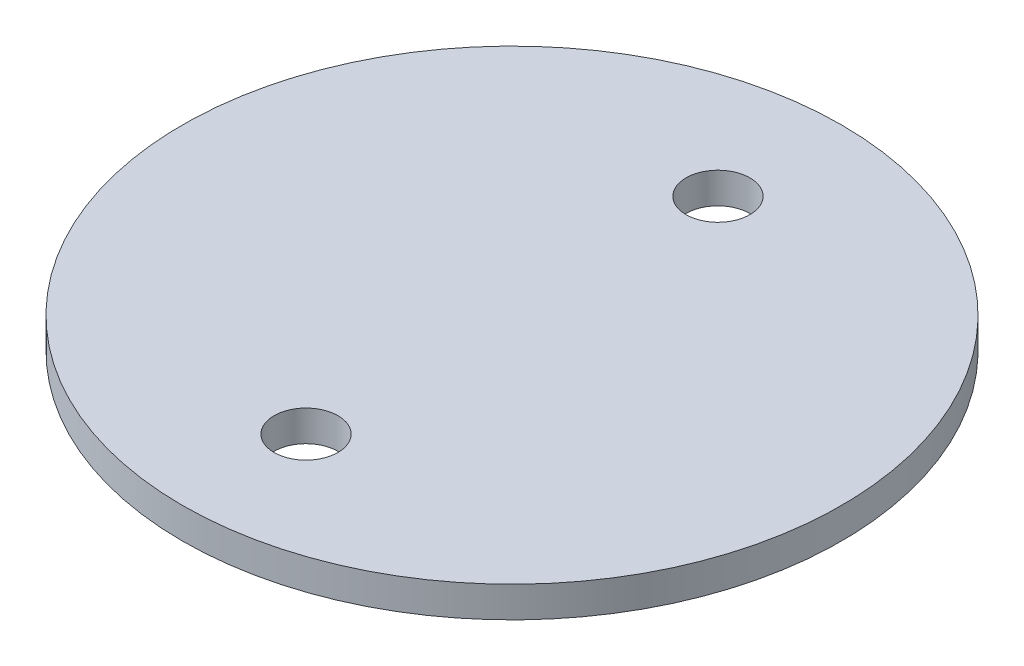
from build123d import *

# Parameters (mm, degrees)
SKETCH1_R           = 32
SKETCH1_R_2         = 3.1
BOSS_EXTRUDE1_DEPTH = 3


with BuildPart() as part:
    # Sketch1 → Boss-Extrude1 (new body)
    with BuildSketch(Plane(origin=(0, 0, 0), x_dir=(1, 0, 0), z_dir=(0, 1, 0))):
        with Locations(Location((0, 0, 0), (0, 0, 270))):
            Circle(SKETCH1_R)
        with Locations(Location((0, 20, 0), (0, 0, 270))):
            Circle(SKETCH1_R_2, mode=Mode.SUBTRACT)
        with Locations(Location((0, -20, 0), (0, 0, 270))):
            Circle(SKETCH1_R_2, mode=Mode.SUBTRACT)
    extrude(amount=BOSS_EXTRUDE1_DEPTH)


solid = part.part
